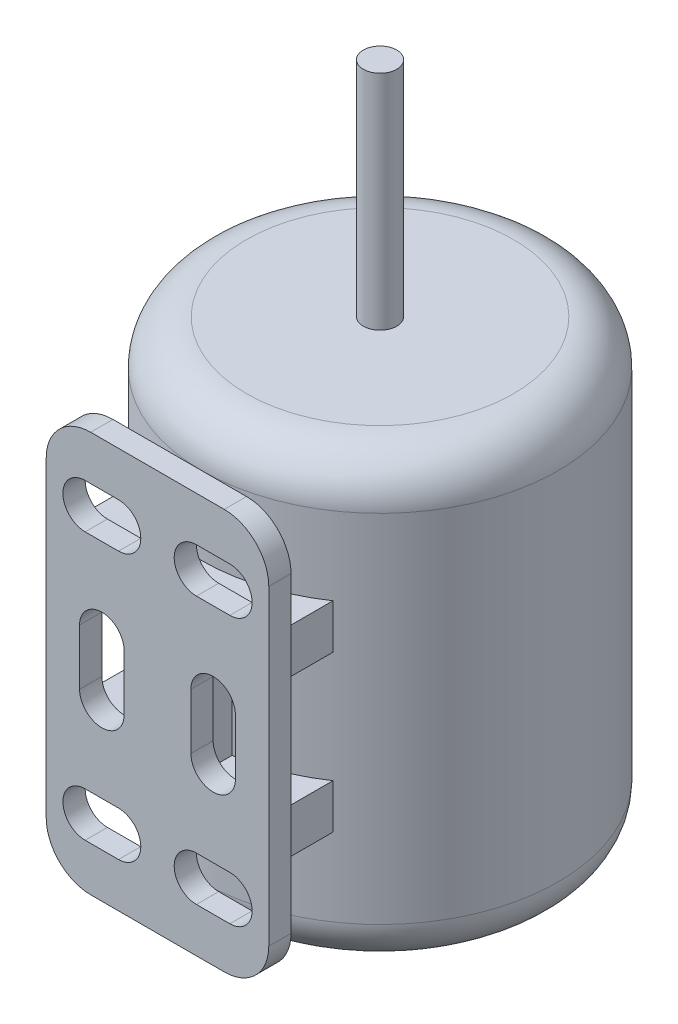
from build123d import *

# Parameters (mm, degrees)
SKETCH2_R                = 80
SKETCH2_R_2              = 7.5
BOSS_EXTRUDE1_DEPTH      = 200
BOSS_EXTRUDE2_DEPTH      = 300
BOSS_EXTRUDE2_DEPTH_BACK = 20
SKETCH2_2_R              = 7.5
FILLET1_R                = 20
BOSS_EXTRUDE3_DEPTH      = 10
CUT_EXTRUDE1_DEPTH       = 10
BOSS_EXTRUDE4_REACH      = 355.977
BOSS_EXTRUDE4_END_RADIUS = 80


with BuildPart() as part:
    # Sketch2 → Boss-Extrude1 (new body)
    with BuildSketch(Plane(origin=(0, 0, 0), x_dir=(1, 0, 0), z_dir=(0, 1, 0))):
        Circle(SKETCH2_R)
        Circle(SKETCH2_R_2, mode=Mode.SUBTRACT)
    extrude(amount=BOSS_EXTRUDE1_DEPTH)

    # Sketch2<2> → Boss-Extrude2 (add, two sides: drawn at the far end of the back side and taken through both)
    with BuildSketch(Plane(origin=(0, 0, 0), x_dir=(1, 0, 0), z_dir=(0, 1, 0)).offset(-BOSS_EXTRUDE2_DEPTH_BACK)):
        Circle(SKETCH2_2_R)
    extrude(amount=BOSS_EXTRUDE2_DEPTH + BOSS_EXTRUDE2_DEPTH_BACK)

    # Fillet1
    fillet1_edges = [part.edges().sort_by_distance(p)[0] for p in [
        (-80, 0, 0),
        (-80, 200, 0),
    ]]
    fillet(fillet1_edges, radius=FILLET1_R)



with BuildPart() as body_2:
    # Sketch3 → Boss-Extrude3 (new body)
    with BuildSketch(Plane.XY.offset(90)):
        with BuildLine():
            Line((-30, 190), (30, 190))
            ThreePointArc((30, 190), (44.142135624, 184.142135624), (50, 170))
            Line((50, 170), (50, 30))
            ThreePointArc((50, 30), (44.142135624, 15.857864376), (30, 10))
            Line((30, 10), (-30, 10))
            ThreePointArc((-30, 10), (-44.142135624, 15.857864376), (-50, 30))
            Line((-50, 30), (-50, 170))
            ThreePointArc((-50, 170), (-44.142135624, 184.142135624), (-30, 190))
        make_face()
    extrude(amount=BOSS_EXTRUDE3_DEPTH)

    # Sketch3<5> → Cut-Extrude1 (cut)
    with BuildSketch(Plane.XY.offset(90)):
        with BuildLine():
            Line((17.5, 170), (32.5, 170))
            ThreePointArc((32.5, 170), (42.5, 160), (32.5, 150))
            Line((32.5, 150), (17.5, 150))
            ThreePointArc((17.5, 150), (7.5, 160), (17.5, 170))
        make_face()
        with BuildLine():
            Line((15, 87.5), (15, 112.5))
            ThreePointArc((15, 112.5), (25, 122.5), (35, 112.5))
            Line((35, 112.5), (35, 87.5))
            ThreePointArc((35, 87.5), (25, 77.5), (15, 87.5))
        make_face()
        with BuildLine():
            Line((-17.5, 170), (-32.5, 170))
            ThreePointArc((-32.5, 170), (-42.5, 160), (-32.5, 150))
            Line((-32.5, 150), (-17.5, 150))
            ThreePointArc((-17.5, 150), (-7.5, 160), (-17.5, 170))
        make_face()
        with BuildLine():
            Line((17.5, 30), (32.5, 30))
            ThreePointArc((32.5, 30), (42.5, 40), (32.5, 50))
            Line((32.5, 50), (17.5, 50))
            ThreePointArc((17.5, 50), (7.5, 40), (17.5, 30))
        make_face()
        with BuildLine():
            Line((-17.5, 30), (-32.5, 30))
            ThreePointArc((-32.5, 30), (-42.5, 40), (-32.5, 50))
            Line((-32.5, 50), (-17.5, 50))
            ThreePointArc((-17.5, 50), (-7.5, 40), (-17.5, 30))
        make_face()
        with BuildLine():
            Line((-15, 87.5), (-15, 112.5))
            ThreePointArc((-15, 112.5), (-25, 122.5), (-35, 112.5))
            Line((-35, 112.5), (-35, 87.5))
            ThreePointArc((-35, 87.5), (-25, 77.5), (-15, 87.5))
        make_face()
    extrude(amount=CUT_EXTRUDE1_DEPTH, mode=Mode.SUBTRACT)


with BuildPart() as part_1:
    add(part.part)

    add(body_2.part)  # Boss-Extrude4 merges body 2
    # Boss-Extrude4: up to this cylinder (the profile starts outside it)
    boss_extrude4_end = Plane(origin=(0, 100, 0), z_dir=(0, -1, 0)) * Cylinder(BOSS_EXTRUDE4_END_RADIUS, 872.954, mode=Mode.PRIVATE)
    # Sketch6 → Boss-Extrude4 (add, up to the surface)
    with BuildSketch(Plane.XY.offset(90), mode=Mode.PRIVATE) as boss_extrude4_sk1:
        Polygon((-45, 75), (-45, 55), (45, 55), (45, 75), (12.5, 75), (12.5, 125), (45, 125), (45, 145), (-45, 145), (-45, 125), (-12.5, 125), (-12.5, 75), align=None)
    boss_extrude4_tool1 = extrude(boss_extrude4_sk1.sketch, amount=-BOSS_EXTRUDE4_REACH, mode=Mode.PRIVATE) - boss_extrude4_end
    add(boss_extrude4_tool1.solids().sort_by_distance((0, 100, 90))[0])


solid = part_1.part
